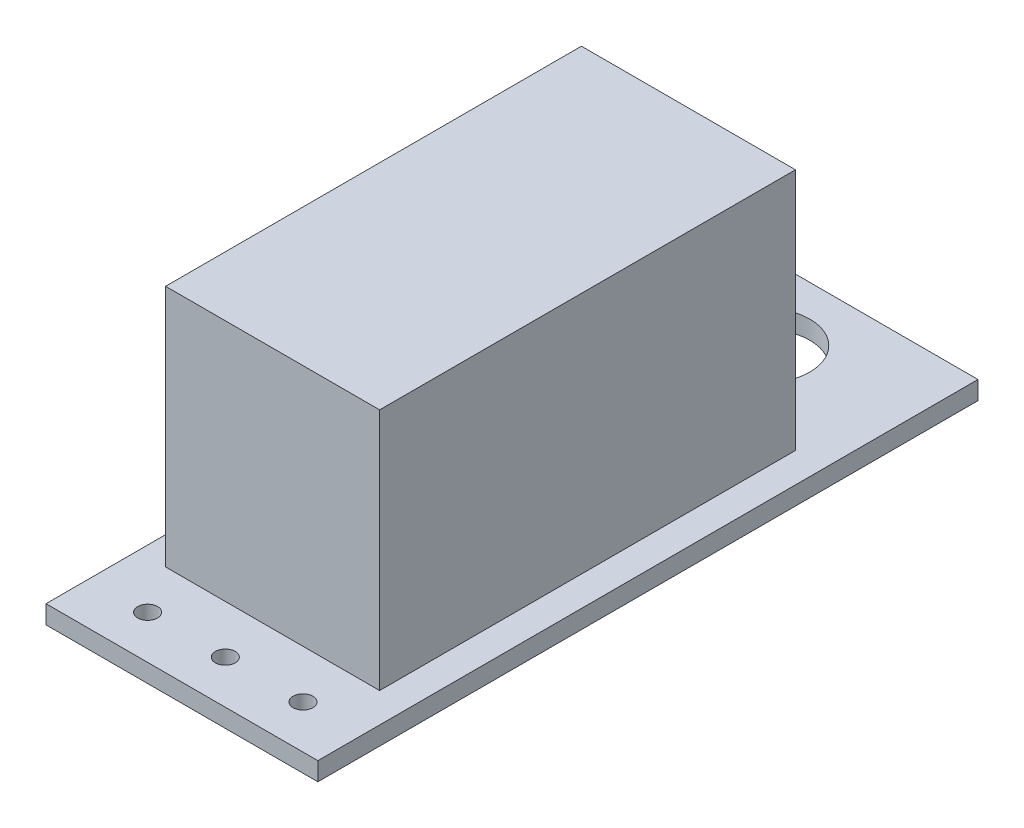
from build123d import *

# Parameters (mm, degrees)
SKETCH1_W           = 7
SKETCH1_H           = 13.6
BOSS_EXTRUDE1_DEPTH = 7.95
SKETCH2_W           = 8.89
SKETCH2_H           = 21.59
SKETCH2_R           = 1.5
SKETCH2_R_2         = 0.325
BOSS_EXTRUDE2_DEPTH = 0.6


with BuildPart() as part:
    # Sketch1 → Boss-Extrude1 (new body)
    with BuildSketch(Plane(origin=(0, 0, 0), x_dir=(1, 0, 0), z_dir=(0, 1, 0))):
        Rectangle(SKETCH1_W, SKETCH1_H)
    extrude(amount=BOSS_EXTRUDE1_DEPTH)

    # Sketch2 → Boss-Extrude2 (add)
    with BuildSketch(Plane.XZ):
        with Locations((0.029445322, -0.999566393)):
            Rectangle(SKETCH2_W, SKETCH2_H)
        with Locations(Location((0.01501125, -9.254566393, 0), (0, 0, 270))):
            Circle(SKETCH2_R, mode=Mode.SUBTRACT)
        with Locations(Location((0.029445322, 8.376560571, 0), (0, 0, 270))):
            Circle(SKETCH2_R_2, mode=Mode.SUBTRACT)
        with Locations(Location((2.569445322, 8.376560571, 0), (0, 0, 270))):
            Circle(SKETCH2_R_2, mode=Mode.SUBTRACT)
        with Locations(Location((-2.510554678, 8.376560571, 0), (0, 0, 270))):
            Circle(SKETCH2_R_2, mode=Mode.SUBTRACT)
    extrude(amount=BOSS_EXTRUDE2_DEPTH)


solid = part.part
